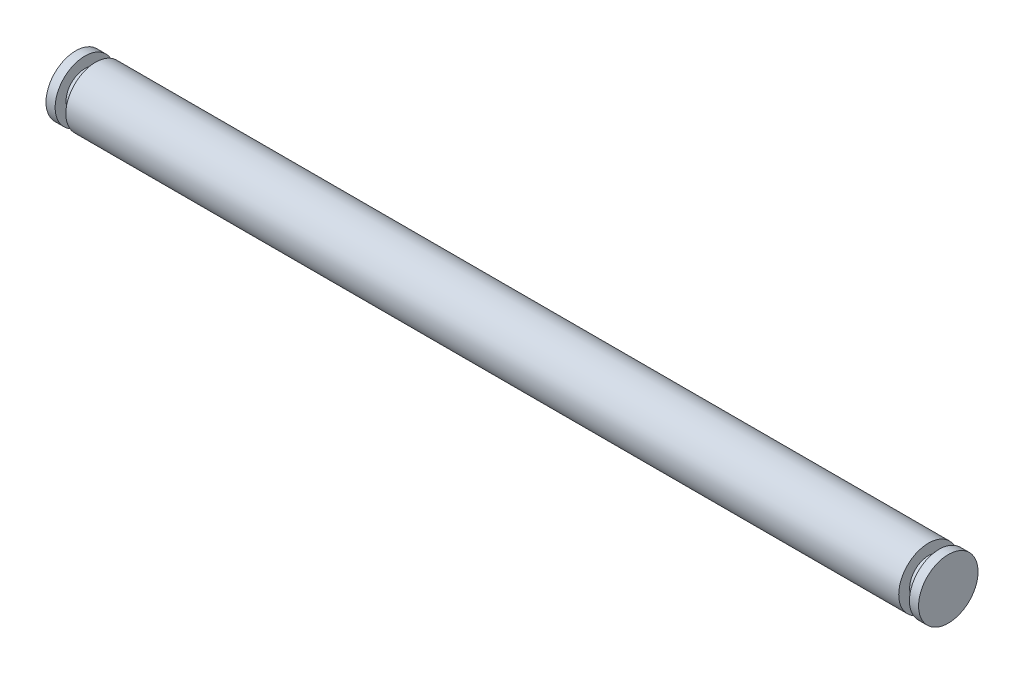
from build123d import *


with BuildPart() as part:
    # Sketch1 → Revolve1 (revolve)
    with BuildSketch(Plane(origin=(0, 0, 0), x_dir=(-1, 0, 0), z_dir=(0, 0, -1)), mode=Mode.PRIVATE) as revolve1_sk:
        Polygon((-22, 1.5), (-22, 0), (22, 0), (22, 1.5), (21.54, 1.5), (21.54, 0.95), (21, 0.95), (21, 1.5), (-21, 1.5), (-21, 0.95), (-21.54, 0.95), (-21.54, 1.5), align=None)
    revolve(revolve1_sk.sketch.rotate(Axis((22, 0, 0), (-1, 0, 0)), 270), axis=Axis((22, 0, 0), (-1, 0, 0)))


solid = part.part
